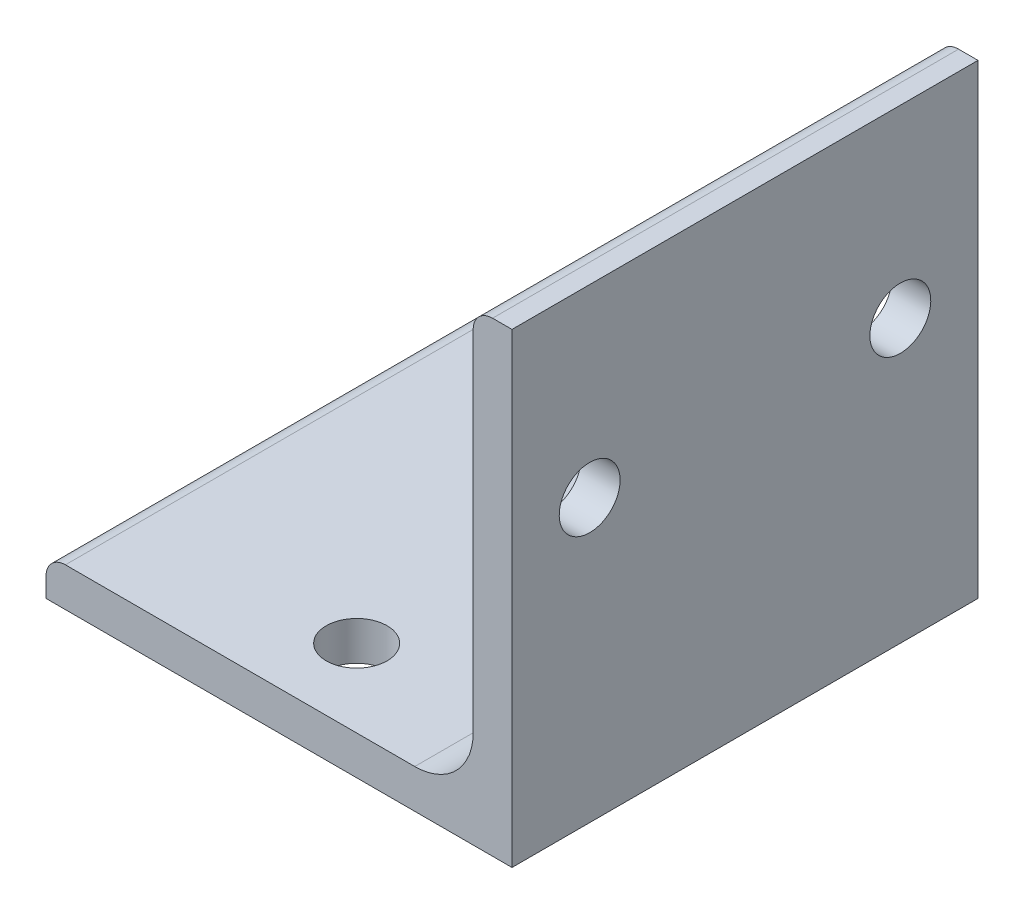
from build123d import *

# Parameters (mm, degrees)
BOSS_EXTRUDE1_DEPTH = 19.05
SKETCH3_R           = 2.4892
CUT_EXTRUDE1_DEPTH  = 47.6627796
SKETCH4_R           = 2.4892
CUT_EXTRUDE2_DEPTH  = 47.6627796


with BuildPart() as part:
    # Sketch2 → Boss-Extrude1 (new, symmetric)
    with BuildSketch(Plane.XY):
        with BuildLine():
            Line((-19.05, -19.05), (19.05, -19.05))
            Line((19.05, -19.05), (19.05, 19.05))
            Line((19.05, 19.05), (17.4625, 19.05))
            ThreePointArc((17.4625, 19.05), (16.339967985, 18.585032015), (15.875, 17.4625))
            Line((15.875, 17.4625), (15.875, -11.0998))
            ThreePointArc((15.875, -11.0998), (14.476376302, -14.476376302), (11.0998, -15.875))
            Line((11.0998, -15.875), (-17.4625, -15.875))
            ThreePointArc((-17.4625, -15.875), (-18.585032015, -16.339967985), (-19.05, -17.4625))
            Line((-19.05, -17.4625), (-19.05, -19.05))
        make_face()
    extrude(amount=BOSS_EXTRUDE1_DEPTH, both=True)

    # Sketch3 → Cut-Extrude1 (cut, through all)
    with BuildSketch(Plane(origin=(19.05, 0, 0), x_dir=(0, 0, -1), z_dir=(1, 0, 0))):
        with Locations(Location((-12.7, 3.96875, 0), (0, 0, 90))):
            Circle(SKETCH3_R)
        with Locations(Location((12.7, 3.96875, 0), (0, 0, 90))):
            Circle(SKETCH3_R)
    extrude(amount=-CUT_EXTRUDE1_DEPTH, mode=Mode.SUBTRACT)

    # Sketch4 → Cut-Extrude2 (cut, through all)
    with BuildSketch(Plane.XZ.offset(19.05)):
        with Locations((0, 12.7)):
            Circle(SKETCH4_R)
        with Locations((0, -12.7)):
            Circle(SKETCH4_R)
    extrude(amount=-CUT_EXTRUDE2_DEPTH, mode=Mode.SUBTRACT)


solid = part.part
